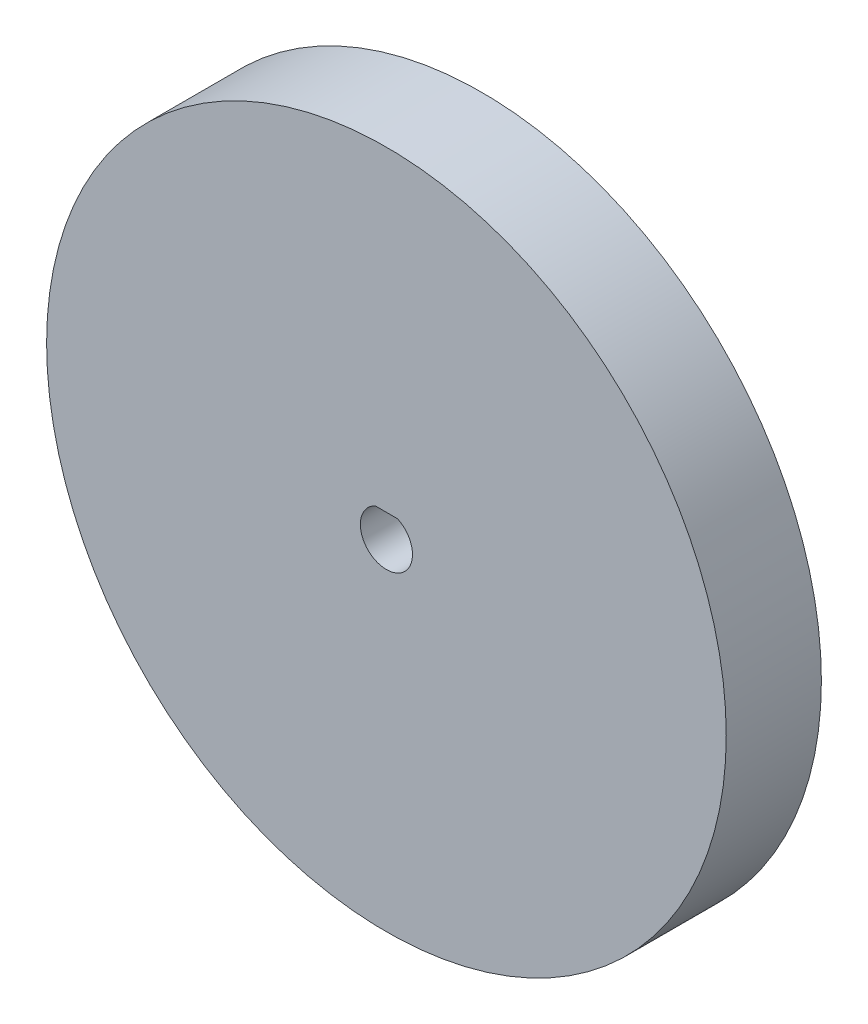
from build123d import *

# Parameters (mm, degrees)
SKETCH1_R           = 38.1
BOSS_EXTRUDE1_DEPTH = 5.334
CUT_EXTRUDE1_DEPTH  = 55.927463295


with BuildPart() as part:
    # Sketch1 → Boss-Extrude1 (new, symmetric)
    with BuildSketch(Plane.XY):
        Circle(SKETCH1_R)
    extrude(amount=BOSS_EXTRUDE1_DEPTH, both=True)

    # Sketch2 → Cut-Extrude1 (cut, through all)
    with BuildSketch(Plane(origin=(0, 0, -5.334), x_dir=(-1, 0, 0), z_dir=(0, 0, -1))):
        with BuildLine():
            Line((-1.2573, 2.636557928), (1.2573, 2.636557928))
            ThreePointArc((1.2573, 2.636557928), (0, -2.921), (-1.2573, 2.636557928))
        make_face()
    extrude(amount=-CUT_EXTRUDE1_DEPTH, mode=Mode.SUBTRACT)


solid = part.part
